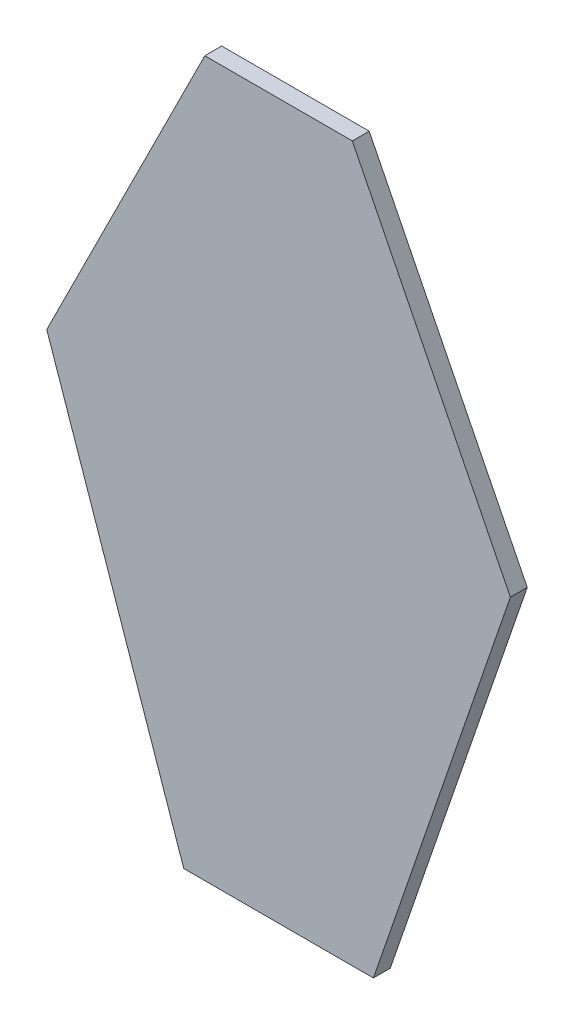
from build123d import *

# Parameters (mm, degrees)
SKETCH_1_R        = 13
EXTRUDE_933_DEPTH = 16
EXTRUDE_1_DEPTH   = 16


with BuildPart() as part:
    # 草图1 → Extrude 933 (new body)
    with BuildSketch(Plane.XY):
        Polygon((-70, 228), (70, 228), (220, -72), (90, -450), (-90, -450), (-220, -72), align=None)
        with Locations((-140, 0)):
            Circle(SKETCH_1_R, mode=Mode.SUBTRACT)
        with Locations((-60, 0)):
            Circle(SKETCH_1_R, mode=Mode.SUBTRACT)
        with Locations(Location((60, -140, 0), (0, 0, 180))):
            Circle(SKETCH_1_R, mode=Mode.SUBTRACT)
        with Locations(Location((140, -140, 0), (0, 0, 180))):
            Circle(SKETCH_1_R, mode=Mode.SUBTRACT)
        with Locations((-140, -140)):
            Circle(SKETCH_1_R, mode=Mode.SUBTRACT)
        with Locations((-60, -140)):
            Circle(SKETCH_1_R, mode=Mode.SUBTRACT)
        with Locations(Location((60, 0, 0), (0, 0, 180))):
            Circle(SKETCH_1_R, mode=Mode.SUBTRACT)
        with Locations(Location((140, 0, 0), (0, 0, 180))):
            Circle(SKETCH_1_R, mode=Mode.SUBTRACT)
        with Locations((0, -400)):
            Circle(SKETCH_1_R, mode=Mode.SUBTRACT)
        with Locations((0, -240)):
            Circle(SKETCH_1_R, mode=Mode.SUBTRACT)
        with Locations((60, 160)):
            Circle(SKETCH_1_R, mode=Mode.SUBTRACT)
        with Locations((0, -320)):
            Circle(SKETCH_1_R, mode=Mode.SUBTRACT)
        with Locations((-60, 160)):
            Circle(SKETCH_1_R, mode=Mode.SUBTRACT)
        with Locations((56, -240)):
            Circle(SKETCH_1_R, mode=Mode.SUBTRACT)
        with Locations((56, -320)):
            Circle(SKETCH_1_R, mode=Mode.SUBTRACT)
        with Locations((56, -400)):
            Circle(SKETCH_1_R, mode=Mode.SUBTRACT)
        with Locations(Location((-56, -400, 0), (0, 0, 180))):
            Circle(SKETCH_1_R, mode=Mode.SUBTRACT)
        with Locations(Location((-56, -320, 0), (0, 0, 180))):
            Circle(SKETCH_1_R, mode=Mode.SUBTRACT)
        with Locations(Location((-56, -240, 0), (0, 0, 180))):
            Circle(SKETCH_1_R, mode=Mode.SUBTRACT)
    extrude(amount=EXTRUDE_933_DEPTH)

    # 草图2 → 凸台-拉伸1 (add)
    with BuildSketch(Plane.XY.offset(16)):
        Polygon((-70, 228), (70, 228), (220, -72), (90, -450), (-90, -450), (-220, -72), align=None)
    extrude(amount=-EXTRUDE_1_DEPTH)


solid = part.part
